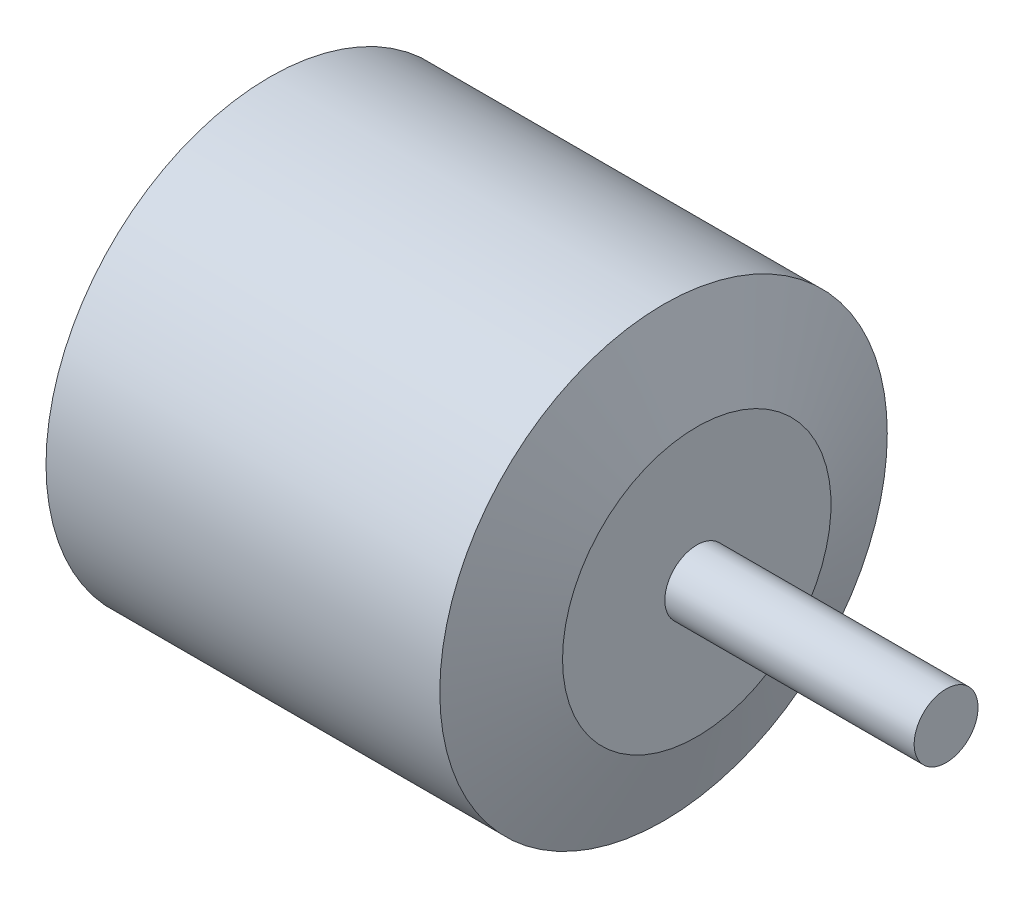
from build123d import *


with BuildPart() as part:
    # Sketch1 → Revolve1 (revolve)
    with BuildSketch(Plane.XY, mode=Mode.PRIVATE) as revolve1_sk:
        Polygon((0, 0), (0, 2.5), (-19.5, 2.5), (-19.5, 10.5), (-22.1, 17.5), (-52.9, 17.5), (-55.5, 10.5), (-55.5, 5.5), (-58, 5.5), (-58, 0), align=None)
    revolve(revolve1_sk.sketch.rotate(Axis((-58, 0, 0), (1, 0, 0)), 90), axis=Axis((-58, 0, 0), (1, 0, 0)))


solid = part.part
